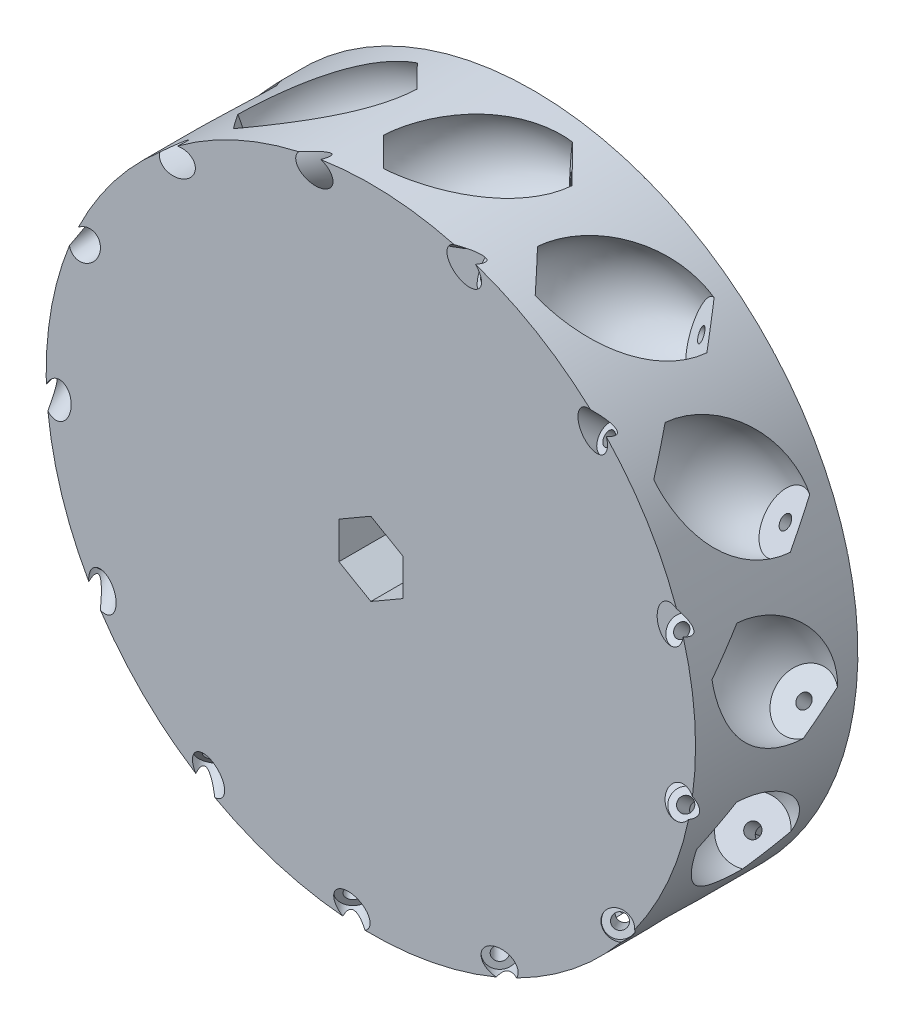
from build123d import *

# Parameters (mm, degrees)
SKETCH1_R           = 76.2
BOSS_EXTRUDE1_DEPTH = 38.1
SKETCH4_R           = 1.585
CUT_EXTRUDE1_DEPTH  = 130.452226308
CUT_EXTRUDE2_START  = -7.62
SKETCH4_4_R         = 3.1
SKETCH4_4_R_2       = 1.585
CUT_EXTRUDE2_DEPTH  = 7.62
CUT_EXTRUDE3_START  = 45.72
SKETCH4_5_R         = 1.585
CUT_EXTRUDE3_DEPTH  = 7.62
CIRPATTERN1_COUNT   = 13


with BuildPart() as part:
    # Sketch1 → Boss-Extrude1 (new body)
    with BuildSketch(Plane.XY):
        Circle(SKETCH1_R)
        Polygon((0, 8.660254038), (-7.5, 4.330127019), (-7.5, -4.330127019), (0, -8.660254038), (7.5, -4.330127019), (7.5, 4.330127019), align=None, mode=Mode.SUBTRACT)
    extrude(amount=BOSS_EXTRUDE1_DEPTH)

    # Sketch2 → Cut-Revolve1 (revolve, cut)
    with BuildSketch(Plane(origin=(61.591726717, 35.56, 0), x_dir=(0, 0, -1), z_dir=(0.8660254037844386, 0.5000000000000002, 0))):
        with BuildLine():
            Line((-25.469756472, 15.783396457), (-30.151576465, 11.101576465))
            Line((-30.151576465, 11.101576465), (-7.948423535, -11.101576465))
            Line((-7.948423535, -11.101576465), (-3.266603543, -6.419756472))
            ThreePointArc((-3.266603543, -6.419756472), (-10.61253285, 8.43746715), (-25.469756472, 15.783396457))
        make_face()
    cut_revolve1 = revolve(axis=Axis((56.040938485, 45.17424724, 30.151576465), (0.35355339059327134, -0.6123724356957907, -0.707106781186552)), mode=Mode.SUBTRACT)

    # Sketch4 → Cut-Extrude1 (cut, symmetric)
    with BuildSketch(Plane(origin=(-10.313288232, 17.863139211, 20.626576465), x_dir=(-0.935414346693486, -0.23145502494313527, -0.26726124191242445), z_dir=(0.3535533905932721, -0.6123724356957909, -0.7071067811865515))):
        with Locations((-70.935652154, 14.409680893)):
            Circle(SKETCH4_R)
    cut_extrude1 = extrude(amount=CUT_EXTRUDE1_DEPTH, both=True, mode=Mode.SUBTRACT)

    # Sketch4<4> → Cut-Extrude2 (cut)
    with BuildSketch(Plane(origin=(-10.313288232, 17.863139211, 20.626576465), x_dir=(-0.935414346693486, -0.23145502494313527, -0.26726124191242445), z_dir=(0.3535533905932721, -0.6123724356957909, -0.7071067811865515)).offset(CUT_EXTRUDE2_START)):
        with Locations((-70.935652154, 14.409680893)):
            Circle(SKETCH4_4_R)
        with Locations((-70.935652154, 14.409680893)):
            Circle(SKETCH4_4_R_2, mode=Mode.SUBTRACT)
    cut_extrude2 = extrude(amount=-CUT_EXTRUDE2_DEPTH, mode=Mode.SUBTRACT)

    # Sketch4<5> → Cut-Extrude3 (cut)
    with BuildSketch(Plane(origin=(-10.313288232, 17.863139211, 20.626576465), x_dir=(-0.935414346693486, -0.23145502494313527, -0.26726124191242445), z_dir=(0.3535533905932721, -0.6123724356957909, -0.7071067811865515)).offset(CUT_EXTRUDE3_START)):
        Polygon((-69.601515071, 12.24700593), (-68.395652154, 14.483740018), (-69.729789237, 16.646414981), (-72.269789237, 16.572355857), (-73.475652154, 14.335621769), (-72.141515071, 12.172946806), align=None)
        with Locations((-70.935652154, 14.409680893)):
            Circle(SKETCH4_5_R, mode=Mode.SUBTRACT)
    cut_extrude3 = extrude(amount=-CUT_EXTRUDE3_DEPTH, mode=Mode.SUBTRACT)

    # CirPattern1: Cut-Revolve1, Cut-Extrude1, Cut-Extrude2, Cut-Extrude3 ×13 about axis
    cirpattern1_axis = Axis((0, 0, 0), (0, 0, 1))
    add([cut_revolve1.rotate(cirpattern1_axis, i * 360 / CIRPATTERN1_COUNT) for i in range(1, CIRPATTERN1_COUNT)], mode=Mode.SUBTRACT)
    add([cut_extrude1.rotate(cirpattern1_axis, i * 360 / CIRPATTERN1_COUNT) for i in range(1, CIRPATTERN1_COUNT)], mode=Mode.SUBTRACT)
    add([cut_extrude2.rotate(cirpattern1_axis, i * 360 / CIRPATTERN1_COUNT) for i in range(1, CIRPATTERN1_COUNT)], mode=Mode.SUBTRACT)
    add([cut_extrude3.rotate(cirpattern1_axis, i * 360 / CIRPATTERN1_COUNT) for i in range(1, CIRPATTERN1_COUNT)], mode=Mode.SUBTRACT)


solid = part.part
